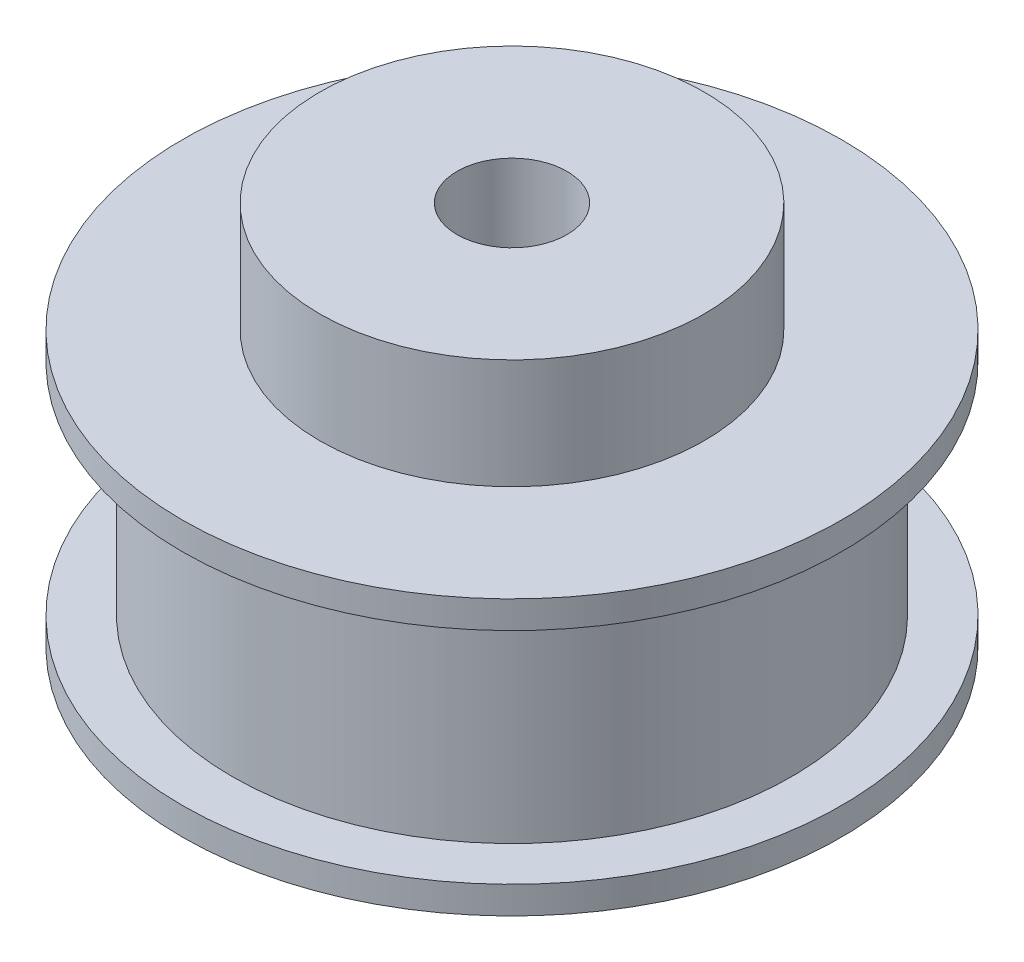
from build123d import *

# Parameters (mm, degrees)
SKETCH1_R           = 19.05
BOSS_EXTRUDE1_DEPTH = 1.5875
SKETCH2_R           = 16.1671
BOSS_EXTRUDE2_DEPTH = 12.7
SKETCH3_R           = 19.05
BOSS_EXTRUDE3_DEPTH = 1.5875
SKETCH4_R           = 11.1125
BOSS_EXTRUDE4_DEPTH = 6.35
CUT_EXTRUDE1_REACH  = 36.925
SKETCH5_R           = 3.175


with BuildPart() as part:
    # Sketch1 → Boss-Extrude1 (new body)
    with BuildSketch(Plane(origin=(0, 0, 0), x_dir=(1, 0, 0), z_dir=(0, 1, 0))):
        with Locations(Location((0, 0, 0), (0, 0, 270))):
            Circle(SKETCH1_R)
    extrude(amount=BOSS_EXTRUDE1_DEPTH)

    # Sketch2 → Boss-Extrude2 (add)
    with BuildSketch(Plane(origin=(0, 1.5875, 0), x_dir=(1, 0, 0), z_dir=(0, 1, 0))):
        with Locations(Location((0, 0, 0), (0, 0, 270))):
            Circle(SKETCH2_R)
    extrude(amount=BOSS_EXTRUDE2_DEPTH)

    # Sketch3 → Boss-Extrude3 (add)
    with BuildSketch(Plane(origin=(0, 14.2875, 0), x_dir=(1, 0, 0), z_dir=(0, 1, 0))):
        with Locations(Location((0, 0, 0), (0, 0, 270))):
            Circle(SKETCH3_R)
    extrude(amount=BOSS_EXTRUDE3_DEPTH)

    # Sketch4 → Boss-Extrude4 (add)
    with BuildSketch(Plane(origin=(0, 15.875, 0), x_dir=(1, 0, 0), z_dir=(0, 1, 0))):
        with Locations(Location((0, 0, 0), (0, 0, 270))):
            Circle(SKETCH4_R)
    extrude(amount=BOSS_EXTRUDE4_DEPTH)

    # Sketch5 → Cut-Extrude1 (cut, up to next)
    with BuildSketch(Plane(origin=(0, 22.225, 0), x_dir=(1, 0, 0), z_dir=(0, 1, 0)), mode=Mode.PRIVATE) as cut_extrude1_sk1:
        with Locations(Location((0, 0, 0), (0, 0, 270))):
            Circle(SKETCH5_R)
    cut_extrude1_tool1 = extrude(cut_extrude1_sk1.sketch, amount=-CUT_EXTRUDE1_REACH, mode=Mode.PRIVATE) & part.part
    add(cut_extrude1_tool1.solids().sort_by_distance((0, 22.225, 0))[0], mode=Mode.SUBTRACT)


solid = part.part
